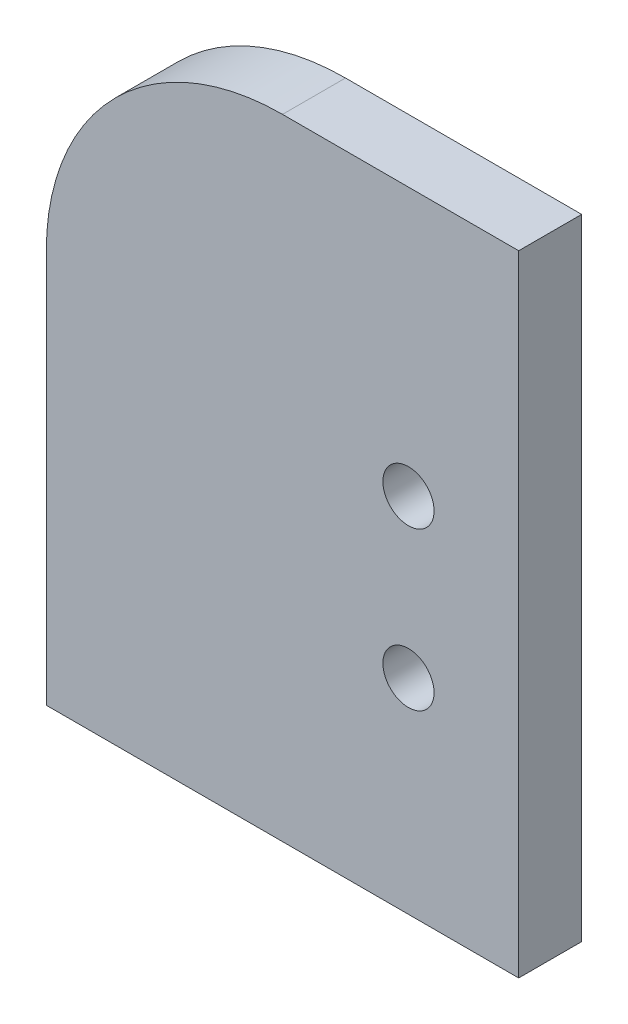
from build123d import *

# Parameters (mm, degrees)
BOSS_EXTRUDE1_DEPTH = 4
SKETCH2_R           = 1.625
CUT_EXTRUDE1_DEPTH  = 51.159744816


with BuildPart() as part:
    # Sketch1 → Boss-Extrude1 (new body)
    with BuildSketch(Plane.XY):
        with BuildLine():
            Line((0, 35), (0, 40))
            Line((0, 40), (-15, 40))
            ThreePointArc((-15, 40), (-25.606601718, 35.606601718), (-30, 25))
            Line((-30, 25), (-30, 0))
            Line((-30, 0), (0, 0))
            Line((0, 0), (0, 35))
        make_face()
    extrude(amount=BOSS_EXTRUDE1_DEPTH)

    # Sketch2 → Cut-Extrude1 (cut, through all)
    with BuildSketch(Plane.XY.offset(4)):
        with Locations((-7, 23)):
            Circle(SKETCH2_R)
        with Locations((-7, 13)):
            Circle(SKETCH2_R)
    extrude(amount=-CUT_EXTRUDE1_DEPTH, mode=Mode.SUBTRACT)


solid = part.part
